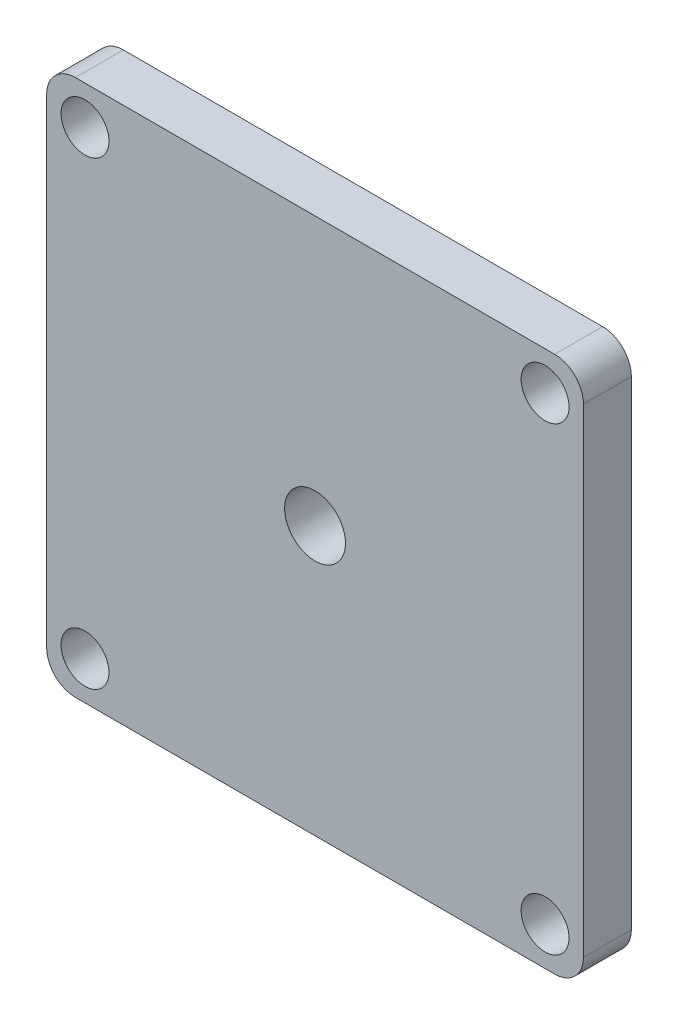
from build123d import *

# Parameters (mm, degrees)
SKETCH1_R           = 2.5
SKETCH1_R_2         = 3.175
BOSS_EXTRUDE1_DEPTH = 5


with BuildPart() as part:
    # Sketch1 → Boss-Extrude1 (new body)
    with BuildSketch(Plane.XY):
        with BuildLine():
            Line((-28, 25), (-28, -25))
            ThreePointArc((-28, -25), (-27.121320344, -27.121320344), (-25, -28))
            Line((-25, -28), (25, -28))
            ThreePointArc((25, -28), (27.121320344, -27.121320344), (28, -25))
            Line((28, -25), (28, 25))
            ThreePointArc((28, 25), (27.121320344, 27.121320344), (25, 28))
            Line((25, 28), (-25, 28))
            ThreePointArc((-25, 28), (-27.121320344, 27.121320344), (-28, 25))
        make_face()
        with Locations((-24, -24)):
            Circle(SKETCH1_R, mode=Mode.SUBTRACT)
        with Locations((24, -24)):
            Circle(SKETCH1_R, mode=Mode.SUBTRACT)
        with Locations((-24, 24)):
            Circle(SKETCH1_R, mode=Mode.SUBTRACT)
        Circle(SKETCH1_R_2, mode=Mode.SUBTRACT)
        with Locations((24, 24)):
            Circle(SKETCH1_R, mode=Mode.SUBTRACT)
    extrude(amount=BOSS_EXTRUDE1_DEPTH)


solid = part.part
